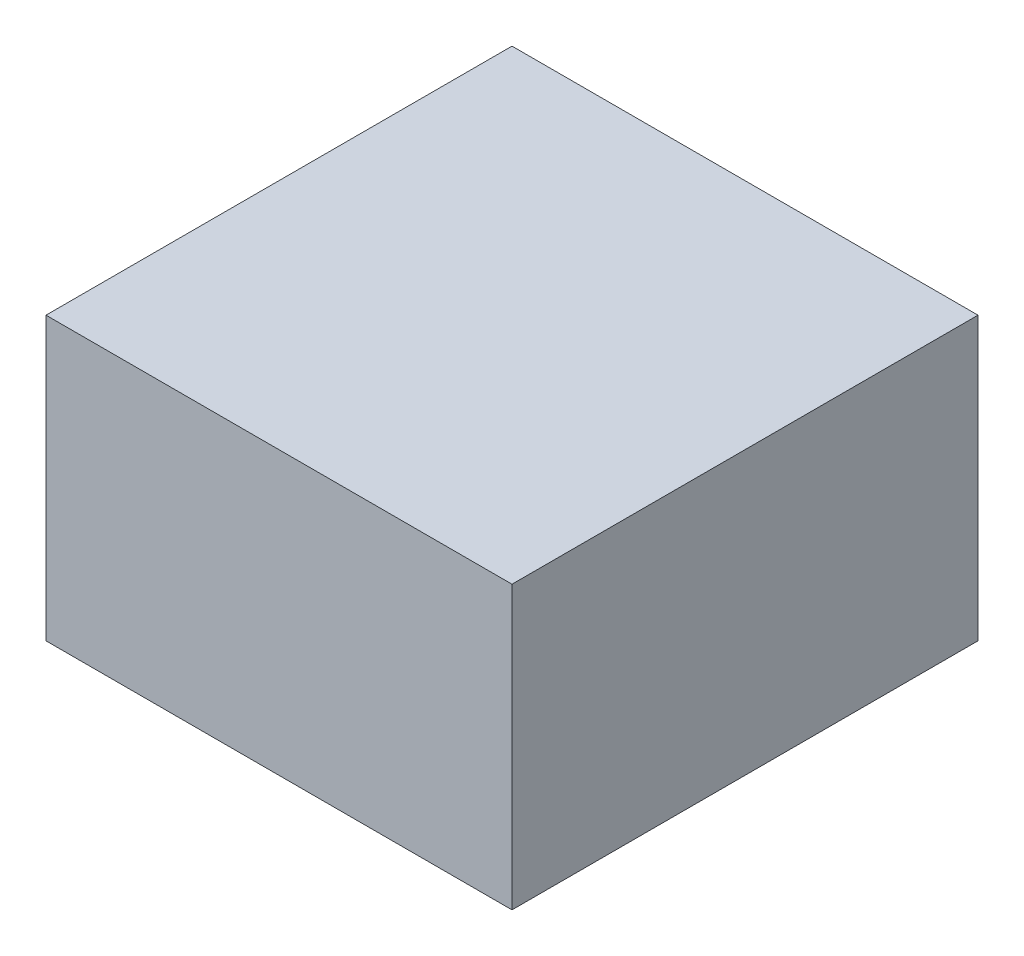
from build123d import *

# Parameters (mm, degrees)
SKETCH1_W           = 38
SKETCH1_H           = 38
BOSS_EXTRUDE1_DEPTH = 23


with BuildPart() as part:
    # Sketch1 → Boss-Extrude1 (new body)
    with BuildSketch(Plane(origin=(0, 0, 0), x_dir=(1, 0, 0), z_dir=(0, 1, 0))):
        Rectangle(SKETCH1_W, SKETCH1_H)
    extrude(amount=BOSS_EXTRUDE1_DEPTH)


solid = part.part
